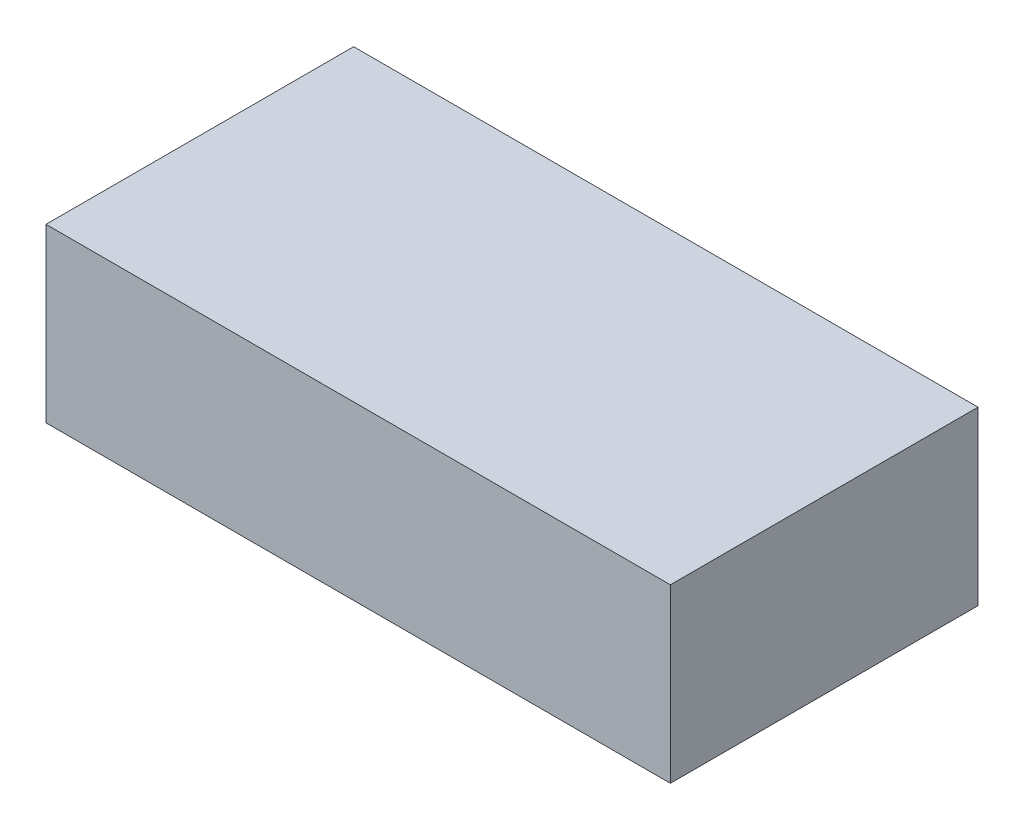
from build123d import *

# Parameters (mm, degrees)
SKETCH_1_W      = 69
SKETCH_1_H      = 34
EXTRUDE_1_DEPTH = 19


with BuildPart() as part:
    # 草图1 → 凸台-拉伸1 (new body)
    with BuildSketch(Plane(origin=(0, 0, 0), x_dir=(1, 0, 0), z_dir=(0, 1, 0))):
        Rectangle(SKETCH_1_W, SKETCH_1_H)
    extrude(amount=EXTRUDE_1_DEPTH)


solid = part.part
